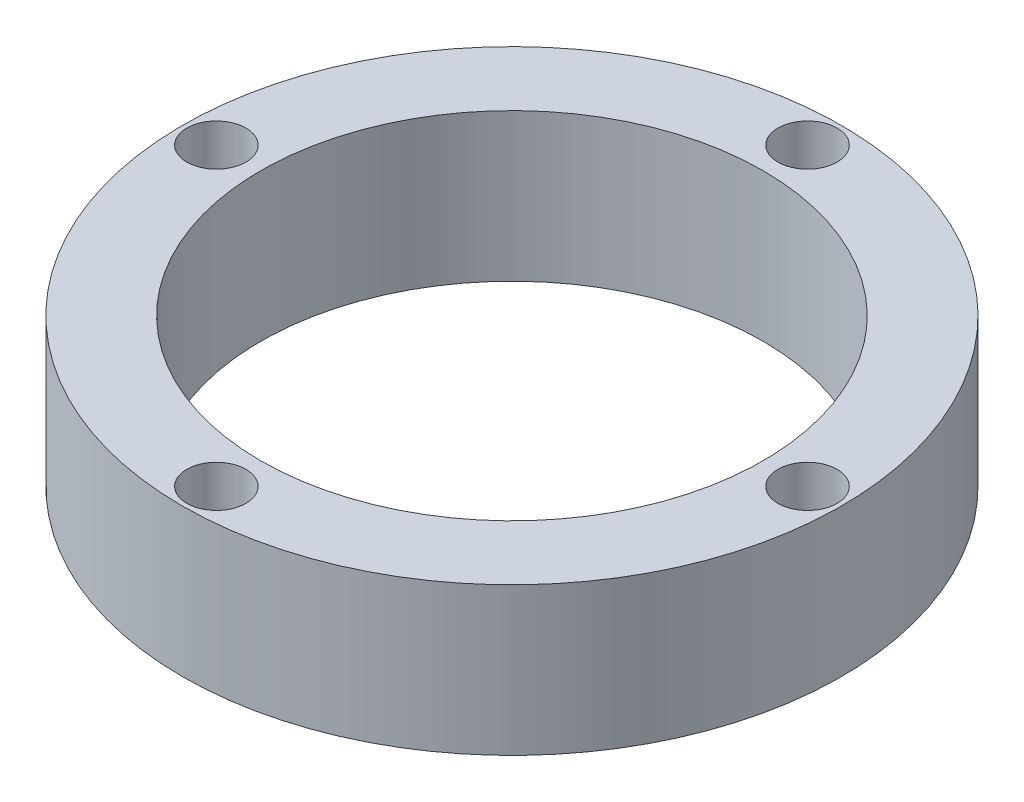
from build123d import *

# Parameters (mm, degrees)
SKETCH1_R           = 22.300536673
SKETCH1_R_2         = 17
BOSS_EXTRUDE1_DEPTH = 10
SKETCH2_R           = 2
CUT_EXTRUDE1_DEPTH  = 34.0851609


with BuildPart() as part:
    # Sketch1 → Boss-Extrude1 (new body)
    with BuildSketch(Plane(origin=(0, 0, 0), x_dir=(1, 0, 0), z_dir=(0, 1, 0))):
        with Locations(Location((0, 0, 0), (0, 0, 270))):
            Circle(SKETCH1_R)
        with Locations(Location((0, 0, 0), (0, 0, 270))):
            Circle(SKETCH1_R_2, mode=Mode.SUBTRACT)
    extrude(amount=BOSS_EXTRUDE1_DEPTH)

    # Sketch2 → Cut-Extrude1 (cut, through all)
    with BuildSketch(Plane(origin=(0, 10, 0), x_dir=(1, 0, 0), z_dir=(0, 1, 0))):
        with Locations(Location((0, 20, 0), (0, 0, 270))):
            Circle(SKETCH2_R)
        with Locations(Location((20, 0, 0), (0, 0, 270))):
            Circle(SKETCH2_R)
        with Locations(Location((0, -20, 0), (0, 0, 270))):
            Circle(SKETCH2_R)
        with Locations(Location((-20, 0, 0), (0, 0, 270))):
            Circle(SKETCH2_R)
    extrude(amount=-CUT_EXTRUDE1_DEPTH, mode=Mode.SUBTRACT)


solid = part.part
